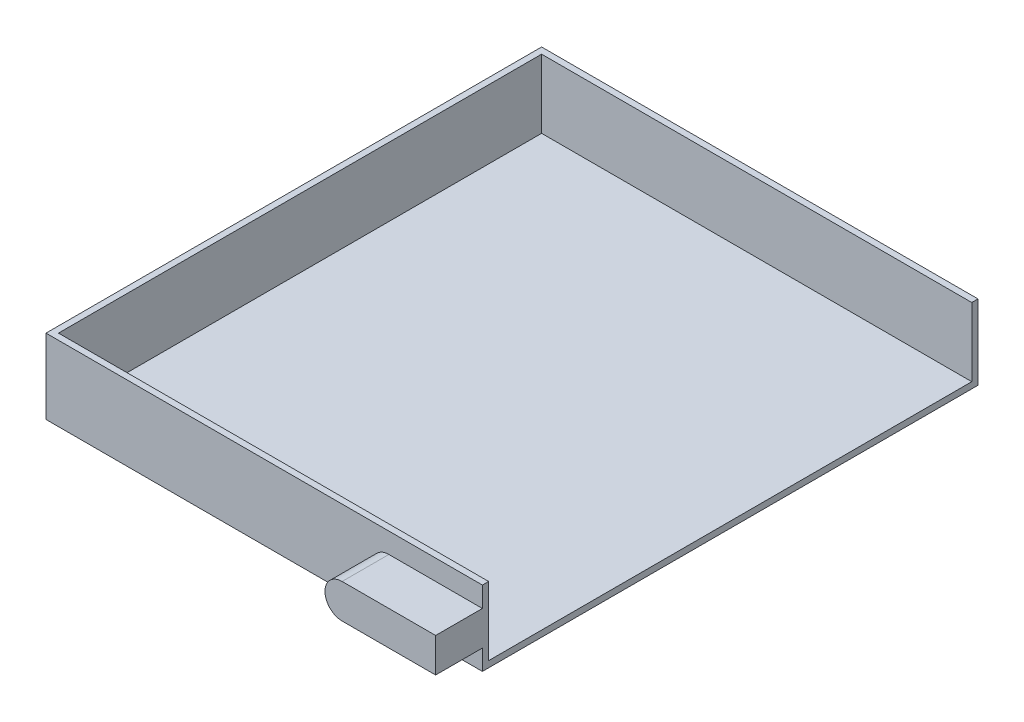
from build123d import *

# Parameters (mm, degrees)
SKETCH_1_W      = 138
SKETCH_1_H      = 155
EXTRUDE_1_DEPTH = 22
SHELL_1_T       = 2
EXTRUDE_2_DEPTH = 15


with BuildPart() as part:
    # 草图1 → 凸台-拉伸1 (new body)
    with BuildSketch(Plane(origin=(0, 0, 0), x_dir=(1, 0, 0), z_dir=(0, 1, 0))):
        with Locations((69, -77.5)):
            Rectangle(SKETCH_1_W, SKETCH_1_H)
    extrude(amount=EXTRUDE_1_DEPTH)

    # 抽壳1
    shell_1_openings = [part.faces().sort_by_distance(p)[0] for p in [
        (138, 11, 77.5),
        (69, 22, 77.5),
    ]]
    offset(amount=SHELL_1_T, openings=shell_1_openings, kind=Kind.INTERSECTION)

    # 草图2 → 凸台-拉伸2 (add)
    with BuildSketch(Plane.XY.offset(157)):
        with BuildLine():
            Line((108, 15.5), (138, 15.5))
            Line((138, 15.5), (138, 4.5))
            Line((138, 4.5), (108, 4.5))
            ThreePointArc((108, 4.5), (102.5, 10), (108, 15.5))
        make_face()
    extrude(amount=EXTRUDE_2_DEPTH)


solid = part.part
